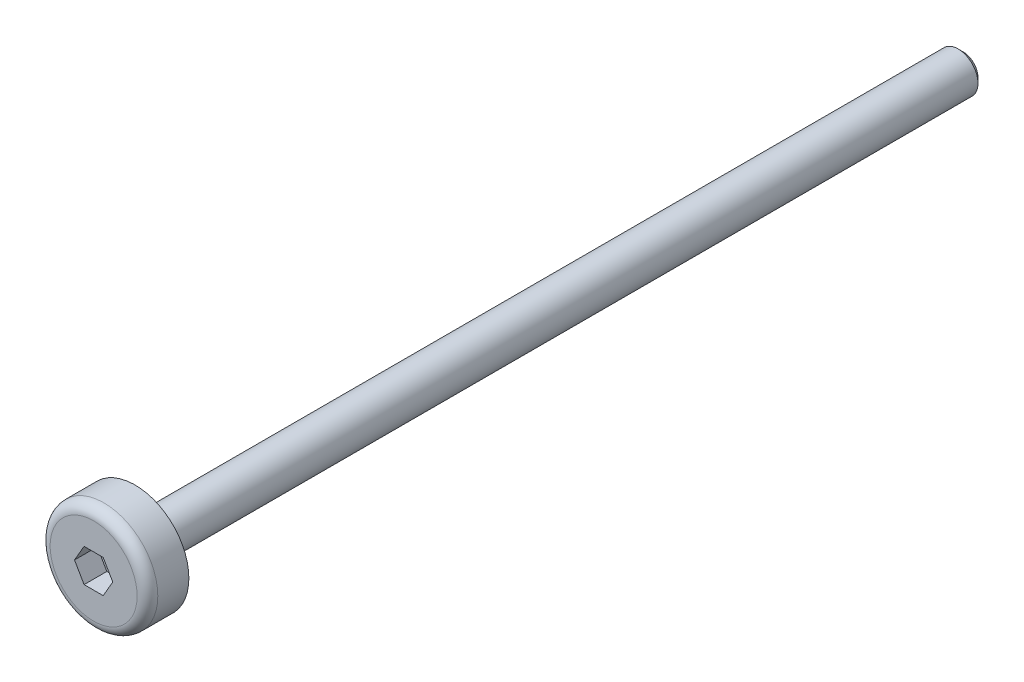
from build123d import *

# Parameters (mm, degrees)
SHANK_TIP_CHAMFER_SIZE = 0.3
PAN_HEAD_ROUND_R       = 0.625
HEX_DRIVE_CUT_DEPTH    = 1.375


with BuildPart() as part:
    # Screw Section → Screw Blank Revolve (revolve)
    with BuildSketch(Plane(origin=(0, 0, 0), x_dir=(1, 0, 0), z_dir=(0, 1, 0))):
        Polygon((0, 50), (1.2, 50), (1.2, 0), (3.25, 0), (3.25, -2.5), (0, -2.5), align=None)
    revolve(axis=Axis((0, 0, 10.123), (0, 0, -1)))

    # Shank Tip Chamfer
    shank_tip_chamfer_edges = [part.edges().sort_by_distance(p)[0] for p in [
        (-1.2, 0, -50),
    ]]
    chamfer(shank_tip_chamfer_edges, length=SHANK_TIP_CHAMFER_SIZE)

    # Pan Head Round
    pan_head_round_edges = [part.edges().sort_by_distance(p)[0] for p in [
        (-3.25, 0, 2.5),
    ]]
    fillet(pan_head_round_edges, radius=PAN_HEAD_ROUND_R)

    # Hex Drive Sketch → Hex Drive Cut (cut)
    with BuildSketch(Plane.XY.offset(2.5)):
        Polygon((1.154700538, 0), (0.577350269, 1), (-0.577350269, 1), (-1.154700538, 0), (-0.577350269, -1), (0.577350269, -1), align=None)
    extrude(amount=-HEX_DRIVE_CUT_DEPTH, mode=Mode.SUBTRACT)


solid = part.part
